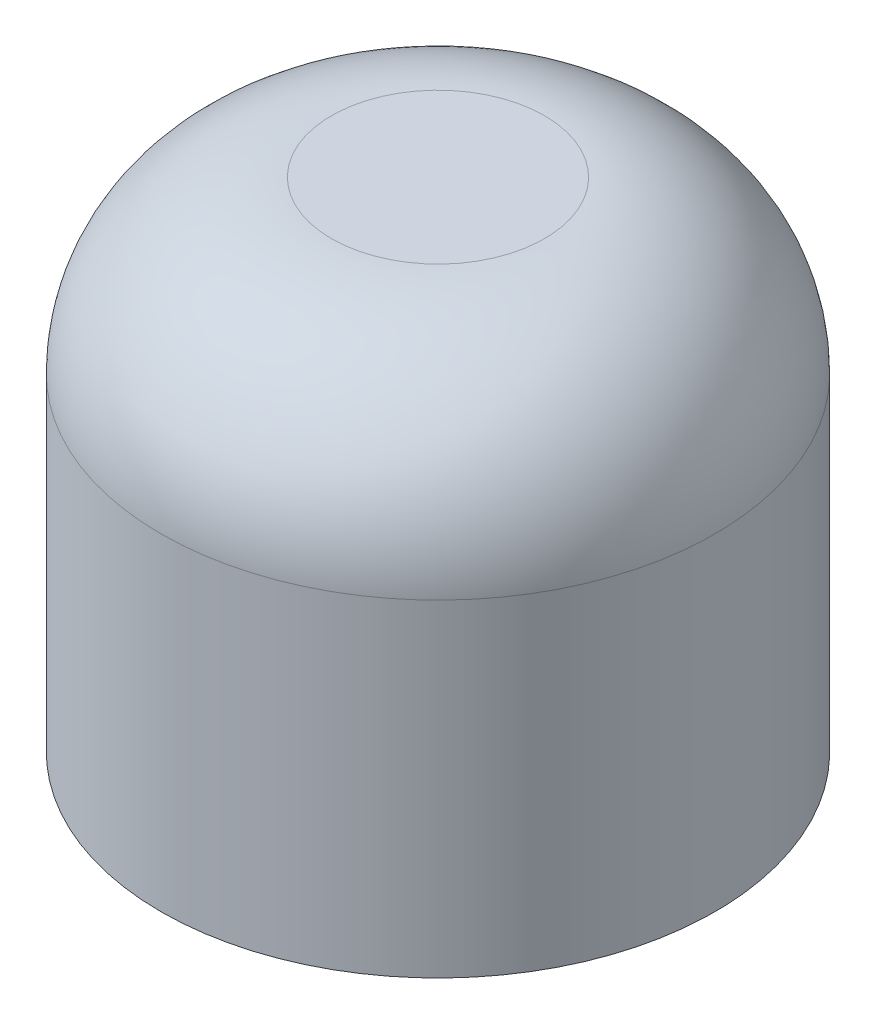
from build123d import *

# Parameters (mm, degrees)
SKETCH1_R           = 16.25
SKETCH1_R_2         = 13.65
BOSS_EXTRUDE1_DEPTH = 24
CHAMFER1_SIZE       = 1
SKETCH3_R           = 16.25
BOSS_EXTRUDE3_DEPTH = 5.2
FILLET3_R           = 10


with BuildPart() as part:
    # Sketch1 → Boss-Extrude1 (new body)
    with BuildSketch(Plane(origin=(0, 0, 0), x_dir=(1, 0, 0), z_dir=(0, 1, 0))):
        with Locations(Location((0, 0, 0), (0, 0, 270))):
            Circle(SKETCH1_R)
        with Locations(Location((0, 0, 0), (0, 0, 270))):
            Circle(SKETCH1_R_2, mode=Mode.SUBTRACT)
    extrude(amount=BOSS_EXTRUDE1_DEPTH)

    # Chamfer1
    chamfer1_edges = [part.edges().sort_by_distance(p)[0] for p in [
        (0, 0, -13.65),
    ]]
    chamfer(chamfer1_edges, length=CHAMFER1_SIZE)

    # Sketch3 → Boss-Extrude3 (add)
    with BuildSketch(Plane(origin=(0, 24, 0), x_dir=(1, 0, 0), z_dir=(0, 1, 0))):
        with Locations(Location((0, 0, 0), (0, 0, 270))):
            Circle(SKETCH3_R)
    extrude(amount=BOSS_EXTRUDE3_DEPTH)

    # Fillet3
    fillet3_edges = [part.edges().sort_by_distance(p)[0] for p in [
        (0, 29.2, -16.25),
    ]]
    fillet(fillet3_edges, radius=FILLET3_R)


solid = part.part
